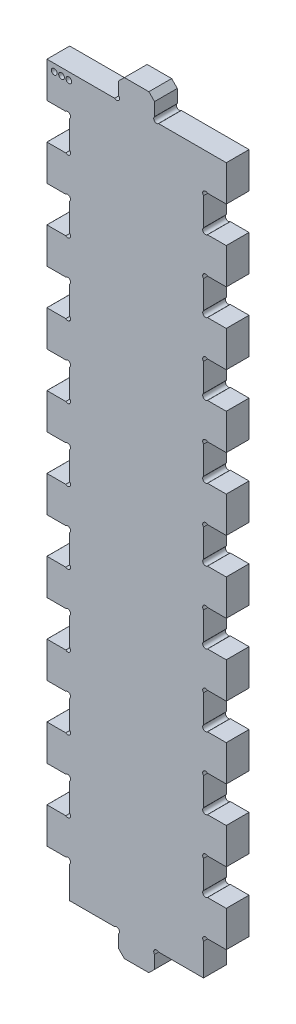
from build123d import *

# Parameters (mm, degrees)
SKETCH1_W           = 50.000000076
SKETCH1_H           = 200.000108
BOSS_EXTRUDE1_DEPTH = 6.35
SKETCH2_W           = 10.0000054
SKETCH2_H           = 6.35
BOSS_EXTRUDE2_DEPTH = 6.35
SKETCH3_W           = 6.35
SKETCH3_H           = 10.0000054
CUT_EXTRUDE1_DEPTH  = 6.35
LPATTERN2_COUNT     = 10
LPATTERN2_PITCH     = 20.0000108
SKETCH4_R           = 0.79375
CUT_EXTRUDE3_DEPTH  = 6.35
LPATTERN3_COUNT     = 9
LPATTERN3_PITCH     = 20.0000108
CHAMFER1_SIZE       = 1.5875
SKETCH5_R           = 0.79375
CUT_EXTRUDE4_DEPTH  = 6.35
SKETCH11_R          = 0.79375
CUT_EXTRUDE10_DEPTH = 213.416311942
SKETCH13_W          = 6.3240118
SKETCH13_H          = 10.0254054
CUT_EXTRUDE12_DEPTH = 213.416311942
LPATTERN6_COUNT     = 10
LPATTERN6_PITCH     = 20.0000108
SKETCH15_R          = 0.79375
CUT_EXTRUDE14_DEPTH = 3.175
LPATTERN8_COUNT     = 3
LPATTERN8_PITCH     = 2.032


with BuildPart() as part:
    # Sketch1 → Boss-Extrude1 (new body)
    with BuildSketch(Plane.XY):
        with Locations((25.000000038, 100.000054)):
            Rectangle(SKETCH1_W, SKETCH1_H)
    extrude(amount=BOSS_EXTRUDE1_DEPTH)

    # Sketch2 → Boss-Extrude2 (add)
    with BuildSketch(Plane.XY):
        with Locations((25.000000038, 203.175108)):
            Rectangle(SKETCH2_W, SKETCH2_H)
        with Locations((25.000000038, -3.175)):
            Rectangle(SKETCH2_W, SKETCH2_H)
    extrude(amount=BOSS_EXTRUDE2_DEPTH)

    # Sketch3 → Cut-Extrude1 (cut)
    with BuildSketch(Plane.XY.offset(6.35)):
        with Locations((3.175, 5.0000027)):
            Rectangle(SKETCH3_W, SKETCH3_H)
        with Locations((46.825000076, 5.0000027)):
            Rectangle(SKETCH3_W, SKETCH3_H)
    cut_extrude1 = extrude(amount=-CUT_EXTRUDE1_DEPTH, mode=Mode.SUBTRACT)

    # LPattern2: Cut-Extrude1 ×10
    with Locations(*[(0, i * LPATTERN2_PITCH, 0) for i in range(1, LPATTERN2_COUNT)]):
        add(cut_extrude1, mode=Mode.SUBTRACT)

    # Sketch4 → Cut-Extrude3 (cut)
    with BuildSketch(Plane.XY.offset(6.35)):
        with Locations((5.788733992, 9.438739392)):
            Circle(SKETCH4_R)
        with Locations((5.788733992, 20.561276808)):
            Circle(SKETCH4_R)
        with Locations((44.211266084, 20.561276808)):
            Circle(SKETCH4_R)
        with Locations((44.211266084, 9.438739392)):
            Circle(SKETCH4_R)
    cut_extrude3 = extrude(amount=-CUT_EXTRUDE3_DEPTH, mode=Mode.SUBTRACT)

    # LPattern3: Cut-Extrude3 ×9
    with Locations(*[(0, i * LPATTERN3_PITCH, 0) for i in range(1, LPATTERN3_COUNT)]):
        add(cut_extrude3, mode=Mode.SUBTRACT)

    # Chamfer1
    chamfer1_edges = [part.edges().sort_by_distance(p)[0] for p in [
        (30.000002738, 206.350108, 3.175),
        (19.999997338, 206.350108, 3.175),
        (19.999997338, -6.35, 3.175),
        (30.000002738, -6.35, 3.175),
    ]]
    chamfer(chamfer1_edges, length=CHAMFER1_SIZE)

    # Sketch5 → Cut-Extrude4 (cut)
    with BuildSketch(Plane.XY.offset(6.35)):
        with Locations((5.788733992, 189.438836592)):
            Circle(SKETCH5_R)
        with Locations((44.211266084, 189.438836592)):
            Circle(SKETCH5_R)
    extrude(amount=-CUT_EXTRUDE4_DEPTH, mode=Mode.SUBTRACT)

    # Sketch11 → Cut-Extrude10 (cut, through all)
    with BuildSketch(Plane.XY):
        with Locations((19.43873133, 200.561374008)):
            Circle(SKETCH11_R)
        with Locations((30.561268746, 200.561374008)):
            Circle(SKETCH11_R)
        with Locations((19.43873133, -0.561266008)):
            Circle(SKETCH11_R)
        with Locations((30.561268746, -0.561266008)):
            Circle(SKETCH11_R)
    extrude(amount=CUT_EXTRUDE10_DEPTH, mode=Mode.SUBTRACT)

    # Sketch13 → Cut-Extrude12 (cut, through all)
    with BuildSketch(Plane.XY.offset(6.35)):
        with Locations((3.175, 5.0000027)):
            Rectangle(SKETCH13_W, SKETCH13_H)
        with Locations((46.825000076, 5.0000027)):
            Rectangle(SKETCH13_W, SKETCH13_H)
    cut_extrude12 = extrude(amount=-CUT_EXTRUDE12_DEPTH, mode=Mode.SUBTRACT)

    # LPattern6: Cut-Extrude12 ×10
    with Locations(*[(0, i * LPATTERN6_PITCH, 0) for i in range(1, LPATTERN6_COUNT)]):
        add(cut_extrude12, mode=Mode.SUBTRACT)

    # Sketch15 → Cut-Extrude14 (cut)
    with BuildSketch(Plane.XY.offset(6.35)):
        with Locations((2.032, 197.968108)):
            Circle(SKETCH15_R)
    cut_extrude14 = extrude(amount=-CUT_EXTRUDE14_DEPTH, mode=Mode.SUBTRACT)

    # LPattern8: Cut-Extrude14 ×3
    with Locations(*[(i * LPATTERN8_PITCH, 0, 0) for i in range(1, LPATTERN8_COUNT)]):
        add(cut_extrude14, mode=Mode.SUBTRACT)


solid = part.part
